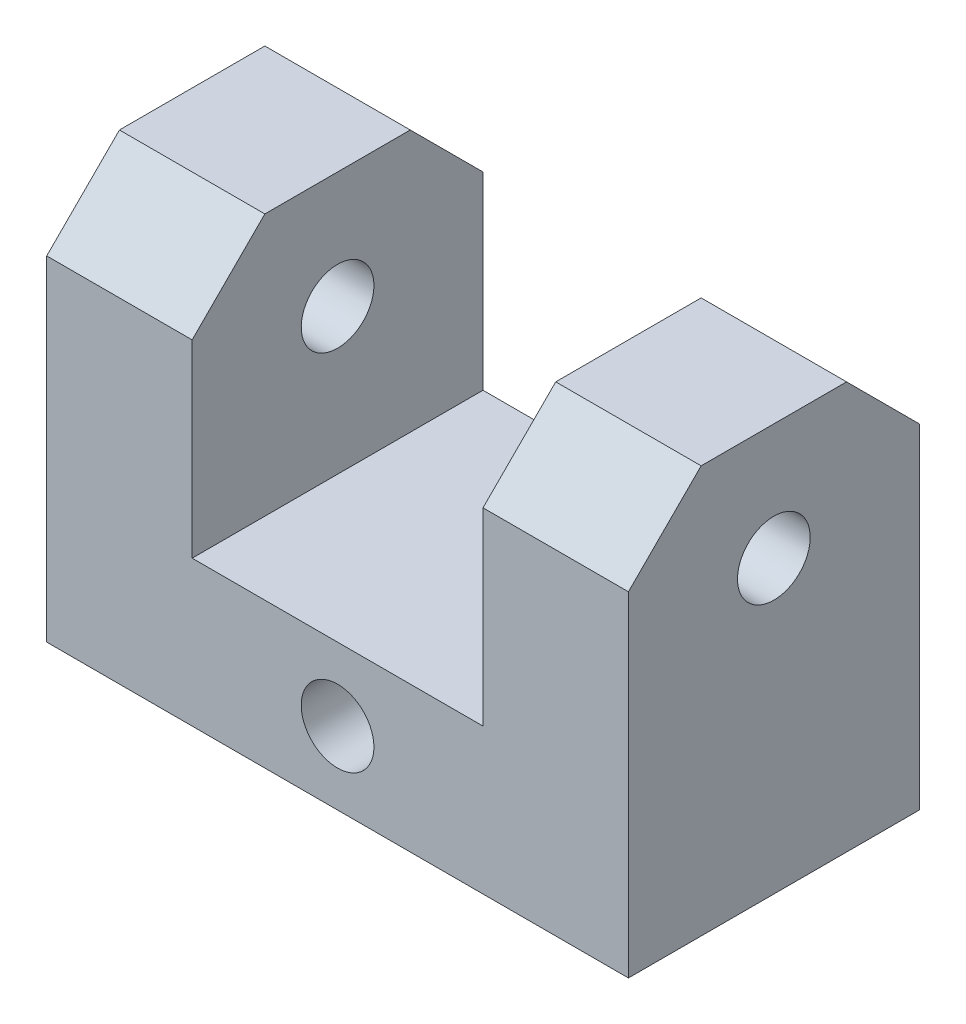
from build123d import *

# Parameters (mm, degrees)
SKETCH1_W               = 50.8
SKETCH1_H               = 25.4
BOSS_EXTRUDE1_DEPTH     = 35.56
CUT_EXTRUDE1_DEPTH      = 51.545361805
CUT_EXTRUDE1_DEPTH_BACK = 51.545361805
SKETCH2_R               = 3.175
SKETCH2_W               = 25.4
SKETCH2_H               = 22.86
CUT_EXTRUDE2_DEPTH      = 64.296473835
CUT_EXTRUDE2_DEPTH_BACK = 64.296473835
SKETCH3_R               = 3.175
CHAMFER2_SIZE           = 6.35


with BuildPart() as part:
    # Sketch1 → Boss-Extrude1 (new body)
    with BuildSketch(Plane(origin=(0, 0, 0), x_dir=(1, 0, 0), z_dir=(0, 1, 0))):
        Rectangle(SKETCH1_W, SKETCH1_H)
    extrude(amount=BOSS_EXTRUDE1_DEPTH)

    # Sketch2 → Cut-Extrude1 (cut, two sides: drawn at the far end of the back side and taken through both)
    with BuildSketch(Plane.XY.offset(12.7).offset(-CUT_EXTRUDE1_DEPTH_BACK)):
        with Locations((0, 6.35)):
            Circle(SKETCH2_R)
        with Locations((0, 24.13)):
            Rectangle(SKETCH2_W, SKETCH2_H)
    extrude(amount=CUT_EXTRUDE1_DEPTH + CUT_EXTRUDE1_DEPTH_BACK, mode=Mode.SUBTRACT)

    # Sketch3 → Cut-Extrude2 (cut, two sides: drawn at the far end of the back side and taken through both)
    with BuildSketch(Plane(origin=(25.4, 0, 0), x_dir=(0, 0, -1), z_dir=(1, 0, 0)).offset(-CUT_EXTRUDE2_DEPTH_BACK)):
        with Locations(Location((0, 25.4, 0), (0, 0, 90))):
            Circle(SKETCH3_R)
    extrude(amount=CUT_EXTRUDE2_DEPTH + CUT_EXTRUDE2_DEPTH_BACK, mode=Mode.SUBTRACT)

    # Chamfer2
    chamfer2_edges = [part.edges().sort_by_distance(p)[0] for p in [
        (19.05, 35.56, -12.7),
        (19.05, 35.56, 12.7),
        (-19.05, 35.56, -12.7),
        (-19.05, 35.56, 12.7),
    ]]
    chamfer(chamfer2_edges, length=CHAMFER2_SIZE)


solid = part.part
